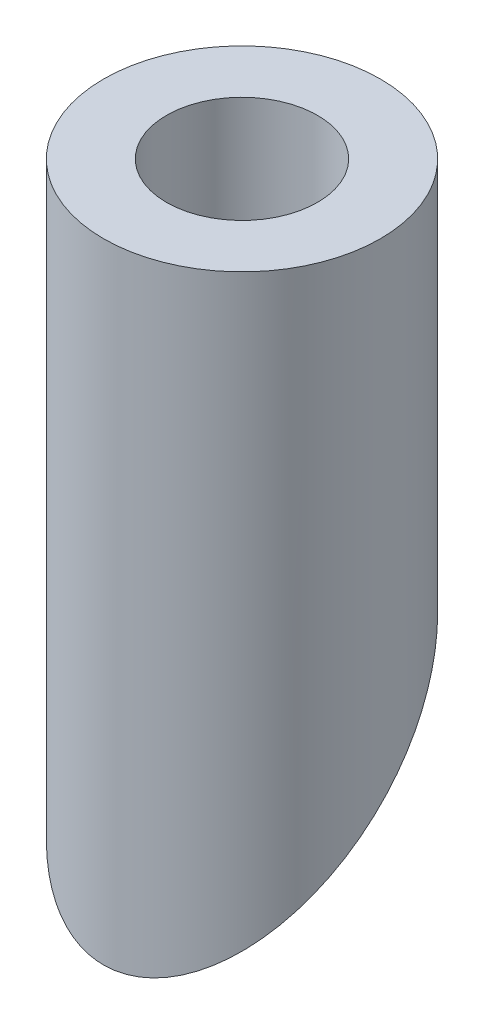
from build123d import *

# Parameters (mm, degrees)
SKETCH_1_R               = 11
SKETCH_1_R_2             = 6
EXTRUDE_1_DEPTH          = 50
CUT_EXTRUDE_1_DEPTH      = 53.364109846
CUT_EXTRUDE_1_DEPTH_BACK = 53.364109846


with BuildPart() as part:
    # 草图1 → 凸台-拉伸1 (new body)
    with BuildSketch(Plane(origin=(0, 0, 0), x_dir=(1, 0, 0), z_dir=(0, 1, 0))):
        with Locations(Location((0, 0, 0), (0, 0, 270))):
            Circle(SKETCH_1_R)
        with Locations(Location((0, 0, 0), (0, 0, 270))):
            Circle(SKETCH_1_R_2, mode=Mode.SUBTRACT)
    extrude(amount=EXTRUDE_1_DEPTH)

    # 草图2 → 切除-拉伸1 (cut, two sides: drawn at the far end of the back side and taken through both)
    with BuildSketch(Plane(origin=(0, 0, 0), x_dir=(0, 0, -1), z_dir=(1, 0, 0)).offset(-CUT_EXTRUDE_1_DEPTH_BACK)):
        Polygon((-11, 0), (11, 22), (11, 0), align=None)
    extrude(amount=CUT_EXTRUDE_1_DEPTH + CUT_EXTRUDE_1_DEPTH_BACK, mode=Mode.SUBTRACT)


solid = part.part
